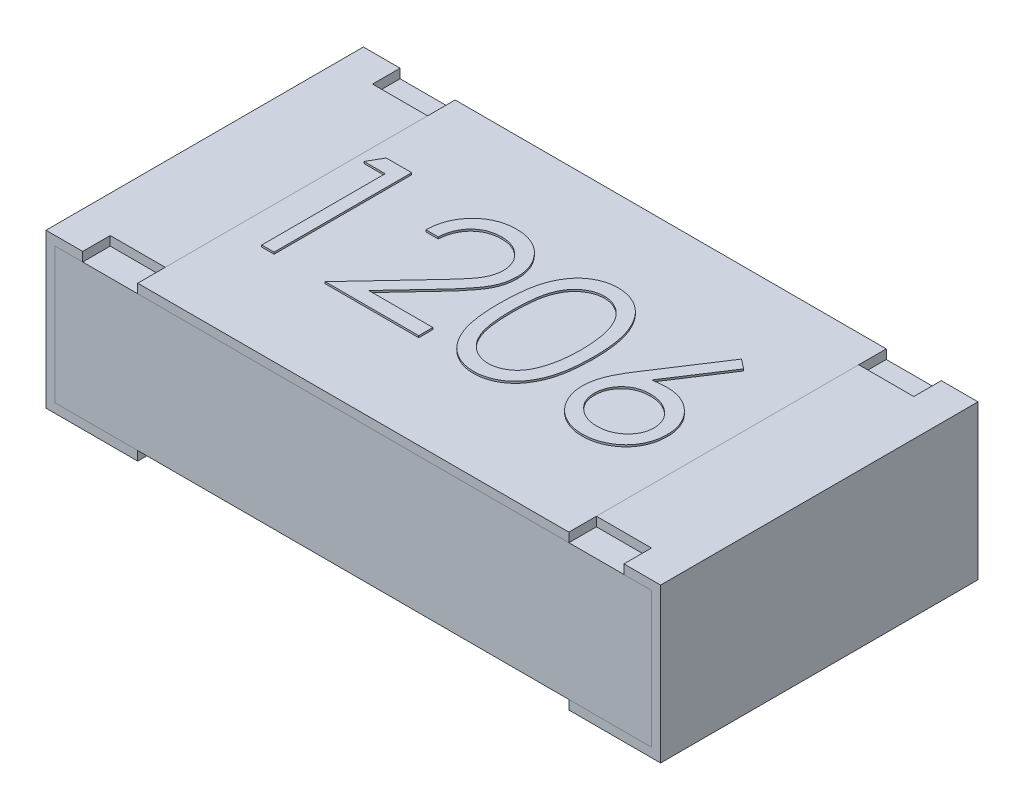
from build123d import *

# Parameters (mm, degrees)
CROQUIS1_W          = 3.25
CROQUIS1_H          = 1.73
EXTRUIR1_DEPTH      = 0.79
CROQUIS2_W          = 3.25
CROQUIS2_H          = 0.05
EXTRUIR2_DEPTH      = 3.501524535
CROQUIS4_W          = 1.73
CROQUIS4_H          = 0.05
EXTRUIR3_DEPTH      = 2.35
CROQUIS5_W          = 0.3
CROQUIS5_H          = 0.15
EXTRUIR4_DEPTH      = 0.05
BOSS_EXTRUDE1_DEPTH = 0.01


with BuildPart() as part:
    # Croquis1 → Extruir1 (new body)
    with BuildSketch(Plane(origin=(0, 0, 0), x_dir=(1, 0, 0), z_dir=(0, 1, 0))):
        Rectangle(CROQUIS1_W, CROQUIS1_H)
    extrude(amount=EXTRUIR1_DEPTH)

    # Croquis2 → Extruir2 (cut, through all)
    with BuildSketch(Plane.XY.offset(0.865)):
        with Locations((0, 0.025)):
            Rectangle(CROQUIS2_W, CROQUIS2_H)
    extrude(amount=-EXTRUIR2_DEPTH, mode=Mode.SUBTRACT)


with BuildPart() as body_2:
    # Barrer1: sweep along a path in Croquis3
    with BuildLine(Plane.XY.offset(0.865)) as barrer1_path:
        Line((-1.175, 0.84), (-1.675, 0.84))
        Line((-1.675, 0.84), (-1.675, 0))
        Line((-1.675, 0), (-1.175, 0))
    # Croquis3D1 → Barrer1 (sweep)
    with BuildSketch(Plane(origin=(-1.175, 0.84, 0.865), x_dir=(0, -0.02888967070388963, -0.9995826063545828), z_dir=(1, 0, 0))):
        Polygon((0, 0), (1.729277909, 0.04997913), (1.730722393, 0), (0.001444484, -0.04997913), align=None)
    sweep(path=barrer1_path.line, transition=Transition.RIGHT)


with BuildPart() as body_3:
    # Simetría1: mirrored copy
    add(body_2.part.mirror(Plane(origin=(0, 0.79, 0.865), x_dir=(0, 0, 1), z_dir=(1, 0, 0))))


with BuildPart() as body_4:
    # Croquis4 → Extruir3 (new body)
    with BuildSketch(Plane(origin=(-1.175, 0, 0), x_dir=(0, 0, -1), z_dir=(1, 0, 0))):
        with Locations((0, 0.815)):
            Rectangle(CROQUIS4_W, CROQUIS4_H)
    extrude(amount=EXTRUIR3_DEPTH)

    # Sketch1 → Boss-Extrude1 (add)
    # profile 1 of 4: a face of its own
    with BuildSketch(Plane(origin=(0, 0.84, 0), x_dir=(1, 0, 0), z_dir=(0, 1, 0))):
        Polygon((-1.07874573, 0.393272708), (-0.940073855, 0.393272708), (-0.940073855, -0.356727292), (-1.007381548, -0.356727292), (-1.007381548, 0.316349631), (-1.122766163, 0.316349631), align=None)
    # profile 2 of 4: a face of its own
    with BuildSketch(Plane(origin=(0, 0.84, 0), x_dir=(1, 0, 0), z_dir=(0, 1, 0))):
        with BuildLine():
            Line((-0.565073855, 0.162503478), (-0.632381548, 0.162503478))
            add(Edge.make_bspline(
                [(-0.632381548, 0.162503478), (-0.631942872, 0.171432954), (-0.631081325, 0.188970207), (-0.627046691, 0.214539615), (-0.621273646, 0.238979929), (-0.613111192, 0.262094911), (-0.602974132, 0.284088941), (-0.590817698, 0.304874659), (-0.576419015, 0.32437277), (-0.560089001, 0.342402523), (-0.542352864, 0.358942716), (-0.523215877, 0.373225983), (-0.503106228, 0.385294055), (-0.482084929, 0.395382893), (-0.459914808, 0.402955717), (-0.436797053, 0.40857464), (-0.412630095, 0.411955285), (-0.396164376, 0.412318668), (-0.387790201, 0.412503478)],
                knots=[0, 0, 0, 0, 1.10065271, 2.161652631, 3.183658789, 4.190468796, 5.17591951, 6.163126047, 7.15150782, 8.156236427, 9.156009102, 10.134482811, 11.092018607, 12.041330605, 13.001268258, 13.972401359, 14.968799086, 16, 16, 16, 16], degree=3))
            add(Edge.make_bspline(
                [(-0.387790201, 0.412503478), (-0.379566328, 0.412310951), (-0.363406712, 0.411932644), (-0.339821994, 0.408683852), (-0.317369717, 0.403595511), (-0.296093767, 0.396456493), (-0.276163896, 0.38685983), (-0.257430386, 0.375331786), (-0.239670213, 0.361998965), (-0.223683045, 0.346301719), (-0.209002742, 0.329544065), (-0.196337973, 0.3116538), (-0.185492295, 0.293176096), (-0.176452078, 0.273970053), (-0.169797191, 0.253854833), (-0.164744718, 0.233123289), (-0.161888844, 0.21156083), (-0.161450539, 0.196966568), (-0.161227701, 0.189546747)],
                knots=[0, 0, 0, 0, 1.111607364, 2.184268762, 3.212621178, 4.221274766, 5.211760367, 6.196651075, 7.1921475, 8.207485113, 9.220403448, 10.201281604, 11.166441695, 12.114753415, 13.065576456, 14.026450734, 14.996634279, 16, 16, 16, 16], degree=3))
            add(Edge.make_bspline(
                [(-0.161227701, 0.189546747), (-0.161590543, 0.179100782), (-0.16230986, 0.158392165), (-0.168462941, 0.127960409), (-0.178072908, 0.098476105), (-0.18964377, 0.074746683), (-0.201316436, 0.05562522), (-0.211835188, 0.039881926), (-0.224149076, 0.022930754), (-0.238437326, 0.004828468), (-0.25440437, -0.014566726), (-0.272194833, -0.035243111), (-0.291935579, -0.056987062), (-0.305790972, -0.071838262), (-0.31297049, -0.079533782)],
                knots=[0, 0, 0, 0, 1.184426356, 2.348067706, 3.509069118, 4.696110526, 5.333549288, 6.050745305, 6.844228056, 7.710549037, 8.667450064, 9.695053472, 10.805634456, 12, 12, 12, 12], degree=3))
            Line((-0.31297049, -0.079533782), (-0.50062073, -0.279804215))
            Line((-0.50062073, -0.279804215), (-0.151612317, -0.279804215))
            Line((-0.151612317, -0.279804215), (-0.151612317, -0.356727292))
            Line((-0.151612317, -0.356727292), (-0.661227701, -0.356727292))
            Line((-0.661227701, -0.356727292), (-0.370362317, -0.046330657))
            add(Edge.make_bspline(
                [(-0.370362317, -0.046330657), (-0.363280627, -0.038938163), (-0.34967815, -0.024738694), (-0.330439026, -0.00400806), (-0.313159243, 0.015223985), (-0.297726944, 0.032921102), (-0.284476907, 0.049342152), (-0.272718572, 0.063955303), (-0.263297374, 0.077402685), (-0.253072646, 0.09298996), (-0.24316965, 0.112021171), (-0.23465986, 0.13527839), (-0.229470964, 0.159219944), (-0.228848499, 0.175398952), (-0.228535394, 0.183537131)],
                knots=[0, 0, 0, 0, 1.329631726, 2.553950428, 3.673215718, 4.687767853, 5.603093632, 6.413772471, 7.123043292, 7.734684054, 8.834405432, 9.900288307, 10.943827018, 12, 12, 12, 12], degree=3))
            add(Edge.make_bspline(
                [(-0.228535394, 0.183537131), (-0.228671624, 0.188654574), (-0.228940108, 0.198740071), (-0.231309615, 0.213527019), (-0.234890438, 0.227790908), (-0.240021564, 0.241575612), (-0.246794437, 0.254742537), (-0.255038733, 0.267307711), (-0.264550889, 0.279455347), (-0.275554733, 0.290845339), (-0.287642916, 0.301277026), (-0.300413112, 0.310517902), (-0.313923849, 0.318240568), (-0.328118161, 0.324571318), (-0.342956475, 0.329537471), (-0.358467492, 0.332978595), (-0.374608353, 0.335139127), (-0.385629816, 0.33543145), (-0.39124573, 0.335580401)],
                knots=[0, 0, 0, 0, 0.991446411, 1.95395049, 2.89581595, 3.838931463, 4.798493298, 5.75982156, 6.748411868, 7.785213223, 8.824556874, 9.840280684, 10.836137867, 11.835679398, 12.848801643, 13.863922112, 14.911575587, 16, 16, 16, 16], degree=3))
            add(Edge.make_bspline(
                [(-0.39124573, 0.335580401), (-0.397110909, 0.33542718), (-0.408629151, 0.335126278), (-0.425540372, 0.333021422), (-0.441673039, 0.32939017), (-0.457067732, 0.32442374), (-0.471750501, 0.318111194), (-0.485649939, 0.310248677), (-0.498734843, 0.3008665), (-0.511029813, 0.290229238), (-0.522357808, 0.278386181), (-0.53231071, 0.265184046), (-0.541007285, 0.250863885), (-0.548594978, 0.235464339), (-0.554756911, 0.218845672), (-0.559465443, 0.201066878), (-0.563191196, 0.182205153), (-0.564435879, 0.169179778), (-0.565073855, 0.162503478)],
                knots=[0, 0, 0, 0, 1.031018746, 2.02475058, 2.990194455, 3.934040569, 4.864654155, 5.795059489, 6.735614925, 7.690564532, 8.649604399, 9.611025574, 10.590972636, 11.591080095, 12.624614302, 13.701020113, 14.821632451, 16, 16, 16, 16], degree=3))
        make_face()
    # profile 3 of 4: a face of its own
    with BuildSketch(Plane(origin=(0, 0.84, 0), x_dir=(1, 0, 0), z_dir=(0, 1, 0))):
        with BuildLine():
            add(Edge.make_bspline(
                [(-0.084304625, 0.017972228), (-0.084234335, 0.029993096), (-0.084097796, 0.053343807), (-0.082578849, 0.087369088), (-0.080055561, 0.11928915), (-0.076597553, 0.149105521), (-0.072389414, 0.176825899), (-0.06677181, 0.202376204), (-0.060383352, 0.225874691), (-0.052979257, 0.247397987), (-0.044624731, 0.267236067), (-0.035531675, 0.285755753), (-0.025339219, 0.302929024), (-0.01462988, 0.319029979), (-0.002970151, 0.333795056), (0.009308162, 0.34743277), (0.022684278, 0.359627931), (0.036703494, 0.370737853), (0.051492736, 0.380477025), (0.066630451, 0.389055469), (0.08222083, 0.396384012), (0.098306441, 0.402146248), (0.114742703, 0.406905715), (0.131587075, 0.41016049), (0.148867367, 0.412208399), (0.160531246, 0.412404185), (0.166446577, 0.412503478)],
                knots=[0, 0, 0, 0, 1.646270934, 3.197905019, 4.663502075, 6.030701355, 7.308322542, 8.50163776, 9.611534131, 10.641858119, 11.616356847, 12.558055219, 13.465016945, 14.349605745, 15.204443733, 16.039544428, 16.859896111, 17.680448484, 18.487036065, 19.28249412, 20.06191084, 20.843045899, 21.620316918, 22.403196591, 23.190181807, 24, 24, 24, 24], degree=3))
            add(Edge.make_bspline(
                [(0.166446577, 0.412503478), (0.172411323, 0.412398946), (0.184273325, 0.412191065), (0.201810548, 0.410193077), (0.218942623, 0.406877837), (0.235596509, 0.402180485), (0.251909007, 0.39635284), (0.267752523, 0.389048458), (0.283225469, 0.380545843), (0.298081959, 0.370555012), (0.312485091, 0.359415953), (0.326081083, 0.346823953), (0.338871173, 0.332906156), (0.351015881, 0.317811471), (0.362170652, 0.301250381), (0.37279353, 0.283510929), (0.382301823, 0.264282886), (0.391459254, 0.243887072), (0.399363608, 0.221759145), (0.406492089, 0.198023839), (0.412251868, 0.172400799), (0.417049569, 0.145024461), (0.420766333, 0.115794286), (0.423473328, 0.084772933), (0.424903274, 0.051939992), (0.425172567, 0.029491881), (0.42531076, 0.017972228)],
                knots=[0, 0, 0, 0, 0.810914788, 1.612654377, 2.396697861, 3.181598691, 3.963628158, 4.749916497, 5.551656086, 6.361998678, 7.18212741, 8.025565596, 8.878627764, 9.750805457, 10.657531673, 11.591944965, 12.560506719, 13.57287815, 14.630710178, 15.753379473, 16.941251878, 18.199788006, 19.531962791, 20.947069417, 22.433333509, 24, 24, 24, 24], degree=3))
            add(Edge.make_bspline(
                [(0.42531076, 0.017972228), (0.425171135, 0.006502819), (0.424899081, -0.015844857), (0.423489358, -0.048530066), (0.420712508, -0.079386789), (0.417238939, -0.108489031), (0.412428019, -0.135715664), (0.406512626, -0.161160903), (0.3999447, -0.184934632), (0.391837244, -0.206842092), (0.38296352, -0.22718889), (0.373308835, -0.246188993), (0.362965301, -0.264010341), (0.351696284, -0.280510287), (0.339684839, -0.295805714), (0.326673884, -0.309626633), (0.313030187, -0.322306062), (0.298584669, -0.333588554), (0.28349648, -0.343463869), (0.268076678, -0.352295409), (0.252051667, -0.359416701), (0.235784606, -0.365531352), (0.219042813, -0.370202878), (0.201847158, -0.373432989), (0.184285107, -0.375698386), (0.172413343, -0.375871203), (0.166446577, -0.375958061)],
                knots=[0, 0, 0, 0, 1.561518951, 3.042555995, 4.452378317, 5.7783523, 7.031515105, 8.214008947, 9.334062868, 10.386615937, 11.391082383, 12.354592575, 13.286541444, 14.194233754, 15.072674879, 15.931287219, 16.775624067, 17.606195743, 18.42308326, 19.229000347, 20.022332153, 20.807536673, 21.593273796, 22.3848459, 23.188221202, 24, 24, 24, 24], degree=3))
            add(Edge.make_bspline(
                [(0.166446577, -0.375958061), (0.16053141, -0.375858128), (0.148867855, -0.375661079), (0.131585192, -0.373622422), (0.114810383, -0.370344814), (0.09846065, -0.365755542), (0.082452111, -0.360138077), (0.067002907, -0.35281943), (0.05194126, -0.344390701), (0.037307355, -0.334791682), (0.023376178, -0.323794179), (0.010069334, -0.311630403), (-0.002278884, -0.297996814), (-0.013771905, -0.283108688), (-0.024694924, -0.267102993), (-0.034742647, -0.249761199), (-0.044036401, -0.231152068), (-0.052531435, -0.211155373), (-0.060063291, -0.189479317), (-0.066716372, -0.165875922), (-0.071969405, -0.140136857), (-0.076465753, -0.11246885), (-0.080092406, -0.082753007), (-0.082568333, -0.050973198), (-0.084098615, -0.017149224), (-0.084234702, 0.006051441), (-0.084304625, 0.017972228)],
                knots=[0, 0, 0, 0, 0.810891512, 1.598919785, 2.382837074, 3.152667961, 3.926044502, 4.706494248, 5.493654104, 6.291793342, 7.103789334, 7.925228297, 8.761435821, 9.622817696, 10.50288917, 11.416980706, 12.369136599, 13.353924996, 14.394355917, 15.514179734, 16.714354668, 17.994756427, 19.357759367, 20.818452758, 22.365282078, 24, 24, 24, 24], degree=3))
        make_face()
        with BuildLine():
            add(Edge.make_bspline(
                [(-0.016996932, 0.018272708), (-0.016971336, 0.00825513), (-0.01692166, -0.011187022), (-0.015623903, -0.03943915), (-0.013855996, -0.065789934), (-0.011575718, -0.090272835), (-0.008189372, -0.112804981), (-0.00439506, -0.133541341), (0.000222388, -0.152372178), (0.005685606, -0.169426709), (0.011908269, -0.184994366), (0.018702383, -0.199480341), (0.026001109, -0.213055756), (0.034169499, -0.225598672), (0.043065584, -0.237149993), (0.052488425, -0.247914171), (0.062789693, -0.257513524), (0.077040495, -0.269026422), (0.095854025, -0.280923379), (0.119558409, -0.291283255), (0.143915934, -0.297793782), (0.160448344, -0.29862173), (0.168700183, -0.299034984)],
                knots=[0, 0, 0, 0, 1.459021318, 2.831673884, 4.118529203, 5.306027144, 6.411944654, 7.436330062, 8.375795394, 9.233974572, 10.042671642, 10.816086306, 11.563610507, 12.285937304, 12.993564865, 13.685989202, 14.367179055, 15.041617293, 16.353048772, 17.594441528, 18.799311195, 20, 20, 20, 20], degree=3))
            add(Edge.make_bspline(
                [(0.168700183, -0.299034984), (0.177005399, -0.298692602), (0.193598682, -0.298008546), (0.217841638, -0.291408817), (0.241376696, -0.281451058), (0.259820683, -0.269676593), (0.273852657, -0.258463379), (0.283906298, -0.248903097), (0.293133879, -0.238198269), (0.301885753, -0.22664842), (0.309912697, -0.214032887), (0.317211941, -0.200412335), (0.323872658, -0.18574894), (0.327667454, -0.175512567), (0.329607635, -0.170278974)],
                knots=[0, 0, 0, 0, 1.353760809, 2.704726607, 4.075137775, 5.516104923, 6.260822281, 7.007110065, 7.778089737, 8.566572457, 9.372053459, 10.217411131, 11.088608312, 12, 12, 12, 12], degree=3))
            add(Edge.make_bspline(
                [(0.329607635, -0.170278974), (0.331868728, -0.163586887), (0.336459717, -0.149999081), (0.342376526, -0.128921155), (0.347036254, -0.106806277), (0.351228404, -0.083786609), (0.354089773, -0.059692388), (0.356392876, -0.034598163), (0.357749452, -0.008485014), (0.357917613, 0.00925677), (0.358003068, 0.018272708)],
                knots=[0, 0, 0, 0, 0.884706709, 1.796334032, 2.740027952, 3.714592787, 4.726048262, 5.777819803, 6.87074269, 8, 8, 8, 8], degree=3))
            add(Edge.make_bspline(
                [(0.358003068, 0.018272708), (0.35788517, 0.027287188), (0.357654537, 0.044921438), (0.356772968, 0.070746762), (0.354496488, 0.095275568), (0.351968105, 0.118613527), (0.348240129, 0.140631449), (0.344220599, 0.161513657), (0.33882034, 0.181001448), (0.333051816, 0.19939993), (0.326449589, 0.21650007), (0.319181931, 0.232381596), (0.311420126, 0.247121179), (0.302989646, 0.260678381), (0.293990571, 0.273113926), (0.284185382, 0.284178482), (0.273963016, 0.294214975), (0.259645048, 0.30567124), (0.240900557, 0.317352318), (0.21757649, 0.328102123), (0.193304209, 0.334275329), (0.176895612, 0.33514569), (0.168700183, 0.335580401)],
                knots=[0, 0, 0, 0, 1.31362396, 2.569729283, 3.763502607, 4.902122613, 5.988968491, 7.01645872, 7.998833611, 8.933434873, 9.825090667, 10.667526885, 11.477055099, 12.250526234, 12.991942729, 13.710640831, 14.402115721, 15.076753259, 16.378508321, 17.609869233, 18.806226677, 20, 20, 20, 20], degree=3))
            add(Edge.make_bspline(
                [(0.168700183, 0.335580401), (0.160405056, 0.335145091), (0.143799691, 0.334273678), (0.119275129, 0.328125123), (0.095767054, 0.317408059), (0.077072131, 0.305632551), (0.062744176, 0.294417198), (0.052655028, 0.28469153), (0.043195134, 0.274053047), (0.034480627, 0.262395493), (0.026318637, 0.2498672), (0.018822706, 0.236369608), (0.012068993, 0.221834316), (0.005836592, 0.206273651), (0.000356709, 0.189220591), (-0.004163426, 0.17041295), (-0.008339223, 0.149742545), (-0.011295352, 0.127088364), (-0.0139233, 0.102599331), (-0.01561216, 0.076182763), (-0.016926001, 0.047883253), (-0.016972815, 0.028340576), (-0.016996932, 0.018272708)],
                knots=[0, 0, 0, 0, 1.207732386, 2.417664972, 3.655092373, 4.956220595, 5.625982001, 6.301752483, 6.994047911, 7.697131622, 8.419323945, 9.170223765, 9.943494443, 10.752040957, 11.610060368, 12.549350801, 13.567764191, 14.679664412, 15.874934091, 17.154273443, 18.533957287, 20, 20, 20, 20], degree=3))
        make_face(mode=Mode.SUBTRACT)
    # profile 4 of 4: a face of its own
    with BuildSketch(Plane(origin=(0, 0.84, 0), x_dir=(1, 0, 0), z_dir=(0, 1, 0))):
        with BuildLine():
            Line((0.838772299, 0.412503478), (0.890605231, 0.371788333))
            Line((0.890605231, 0.371788333), (0.692438164, 0.068753478))
            add(Edge.make_bspline(
                [(0.692438164, 0.068753478), (0.705631795, 0.070856448), (0.731367463, 0.074958529), (0.757417299, 0.075635231), (0.770112443, 0.075965016)],
                knots=[0, 0, 0, 0, 1.025318673, 2, 2, 2, 2], degree=3))
            add(Edge.make_bspline(
                [(0.770112443, 0.075965016), (0.777735121, 0.075760135), (0.792740135, 0.075356833), (0.814770164, 0.07225315), (0.835939222, 0.067362055), (0.856159567, 0.060232286), (0.875503778, 0.051124639), (0.894082862, 0.040209166), (0.911547579, 0.026922235), (0.928122832, 0.012079744), (0.943171495, -0.00435961), (0.956494936, -0.021802753), (0.967686391, -0.040231513), (0.976766517, -0.059636556), (0.983817563, -0.079987969), (0.988957772, -0.101259713), (0.991996256, -0.123466457), (0.992408862, -0.138568923), (0.992618452, -0.146240513)],
                knots=[0, 0, 0, 0, 1.04369286, 2.054478336, 3.041073146, 4.015093852, 4.984733326, 5.965804835, 6.960378782, 7.985147595, 9.009457201, 10.008161701, 10.986880575, 11.956520048, 12.937015923, 13.931873656, 14.949455224, 16, 16, 16, 16], degree=3))
            add(Edge.make_bspline(
                [(0.992618452, -0.146240513), (0.992313501, -0.156736164), (0.99171343, -0.177389121), (0.985734045, -0.207469843), (0.976442693, -0.236126811), (0.963161794, -0.262902491), (0.946665569, -0.287760184), (0.926548942, -0.309785641), (0.903525337, -0.32942922), (0.877492452, -0.345855639), (0.849476102, -0.359270578), (0.820043531, -0.368905987), (0.789480571, -0.374838159), (0.768736727, -0.37558186), (0.758243452, -0.375958061)],
                knots=[0, 0, 0, 0, 1.031375318, 2.029502543, 3.004789286, 3.987476834, 4.960371455, 5.9300674, 6.912260825, 7.929083631, 8.949397511, 9.960523116, 10.96833055, 12, 12, 12, 12], degree=3))
            add(Edge.make_bspline(
                [(0.758243452, -0.375958061), (0.748151302, -0.375630588), (0.72816052, -0.374981922), (0.698753493, -0.369203507), (0.670497132, -0.359837699), (0.643589407, -0.346934639), (0.618663562, -0.330636522), (0.596363782, -0.311016033), (0.576801259, -0.288492577), (0.560520983, -0.263069645), (0.547608398, -0.235750368), (0.537924842, -0.207263835), (0.532268505, -0.177713839), (0.5314781, -0.157682166), (0.531079991, -0.147592676)],
                knots=[0, 0, 0, 0, 1.012016664, 2.004627821, 2.994792927, 3.992885782, 4.990978636, 5.973936114, 6.964471063, 7.975201453, 8.993600317, 9.990122807, 10.98767138, 12, 12, 12, 12], degree=3))
            add(Edge.make_bspline(
                [(0.531079991, -0.147592676), (0.531333158, -0.139868837), (0.531850076, -0.124098233), (0.535459374, -0.100213084), (0.541258973, -0.075773567), (0.547754025, -0.055040525), (0.554616656, -0.038055913), (0.560327915, -0.024362308), (0.567436628, -0.01027065), (0.575016638, 0.004702272), (0.583750253, 0.020170579), (0.593246464, 0.036392794), (0.603767817, 0.053110922), (0.611143567, 0.064456106), (0.614914125, 0.070255881)],
                knots=[0, 0, 0, 0, 1.173818275, 2.396712641, 3.66331629, 4.989737886, 5.693666774, 6.447286557, 7.243889047, 8.091586357, 8.998013824, 9.943181721, 10.948533338, 12, 12, 12, 12], degree=3))
            Line((0.614914125, 0.070255881), (0.838772299, 0.412503478))
        make_face()
        with BuildLine():
            add(Edge.make_bspline(
                [(0.755989847, -0.000958061), (0.750276508, -0.001124784), (0.739116699, -0.001450444), (0.722743682, -0.00334157), (0.707247985, -0.006902798), (0.692424314, -0.01143844), (0.678549806, -0.01767481), (0.665523626, -0.025250196), (0.6532954, -0.03416902), (0.641993211, -0.044304929), (0.63174614, -0.055402365), (0.622921612, -0.067288691), (0.615309669, -0.079677449), (0.609120708, -0.092672151), (0.604301406, -0.106267829), (0.600815352, -0.120401954), (0.598875263, -0.135169306), (0.598552499, -0.145183413), (0.598387683, -0.150297003)],
                knots=[0, 0, 0, 0, 1.129588631, 2.206414736, 3.251139165, 4.268635594, 5.265702196, 6.250456724, 7.242448911, 8.251968645, 9.246821453, 10.222880186, 11.173611482, 12.116736599, 13.062300278, 14.020270554, 14.989073742, 16, 16, 16, 16], degree=3))
            add(Edge.make_bspline(
                [(0.598387683, -0.150297003), (0.598521903, -0.155364856), (0.59878509, -0.165302161), (0.601174872, -0.179946271), (0.604825247, -0.194038751), (0.610255332, -0.207506951), (0.616732522, -0.220556162), (0.625283663, -0.232713723), (0.634758689, -0.244718024), (0.646084532, -0.255646911), (0.658239538, -0.265816187), (0.67122551, -0.274704813), (0.684759787, -0.282308993), (0.699025092, -0.288268514), (0.713819031, -0.293159432), (0.729264864, -0.296601178), (0.745373333, -0.298547005), (0.756285177, -0.298870189), (0.761849222, -0.299034984)],
                knots=[0, 0, 0, 0, 0.989467248, 1.94019797, 2.891935182, 3.827694429, 4.772920941, 5.730924762, 6.725747692, 7.756678648, 8.79901574, 9.819492441, 10.826891316, 11.826466727, 12.835195252, 13.867842842, 14.912794438, 16, 16, 16, 16], degree=3))
            add(Edge.make_bspline(
                [(0.761849222, -0.299034984), (0.767413257, -0.298870176), (0.778325083, -0.298546967), (0.794433682, -0.296601323), (0.809879036, -0.293158899), (0.824674716, -0.288270448), (0.838933594, -0.282301817), (0.852456034, -0.27475212), (0.865319197, -0.265761524), (0.877482183, -0.255664289), (0.888760884, -0.244655821), (0.898463158, -0.23282088), (0.906752422, -0.220457903), (0.91348832, -0.207558355), (0.918858596, -0.194030608), (0.922527482, -0.179948452), (0.92491233, -0.16530159), (0.925176194, -0.155364663), (0.92531076, -0.150297003)],
                knots=[0, 0, 0, 0, 1.087397944, 2.132534446, 3.165364764, 4.174271784, 5.174024072, 6.181601208, 7.194203697, 8.236725232, 9.267838612, 10.269026844, 11.221737037, 12.171628256, 13.107553087, 14.05945871, 15.010357665, 16, 16, 16, 16], degree=3))
            add(Edge.make_bspline(
                [(0.92531076, -0.150297003), (0.92519284, -0.145176742), (0.924961402, -0.135127335), (0.922343698, -0.12040856), (0.91871319, -0.106196016), (0.913231112, -0.092579027), (0.906108995, -0.079611328), (0.897433979, -0.067227413), (0.887398428, -0.055332339), (0.875806099, -0.044283166), (0.863186763, -0.034180221), (0.849769137, -0.025261744), (0.835731714, -0.017734963), (0.821088727, -0.01145487), (0.805672395, -0.00692284), (0.789731608, -0.003354288), (0.773062484, -0.001455284), (0.761753211, -0.001125913), (0.755989847, -0.000958061)],
                knots=[0, 0, 0, 0, 0.978206639, 1.919901502, 2.851605144, 3.780102724, 4.718870031, 5.675451981, 6.667674623, 7.690630536, 8.733308323, 9.756129687, 10.767539656, 11.776269907, 12.797430371, 13.836405707, 14.897401972, 16, 16, 16, 16], degree=3))
        make_face(mode=Mode.SUBTRACT)
    extrude(amount=BOSS_EXTRUDE1_DEPTH)


with BuildPart() as extruir4_tool:
    # Croquis5 → Extruir4 (new body)
    with BuildSketch(Plane(origin=(0, 0.84, 0), x_dir=(1, 0, 0), z_dir=(0, 1, 0))):
        with Locations((-1.325, -0.79)):
            Rectangle(CROQUIS5_W, CROQUIS5_H)
        with Locations((-1.325, 0.79)):
            Rectangle(CROQUIS5_W, CROQUIS5_H)
        with Locations((1.325, 0.79)):
            Rectangle(CROQUIS5_W, CROQUIS5_H)
        with Locations((1.325, -0.79)):
            Rectangle(CROQUIS5_W, CROQUIS5_H)
    extrude(amount=-EXTRUIR4_DEPTH)


with BuildPart() as body_2_1:
    add(body_2.part)

    # Extruir4: cut by extruir4_tool
    add(extruir4_tool.part, mode=Mode.SUBTRACT)


with BuildPart() as body_3_1:
    add(body_3.part)

    # Extruir4: cut by extruir4_tool
    add(extruir4_tool.part, mode=Mode.SUBTRACT)


solid = Compound([part.part, body_4.part, body_2_1.part, body_3_1.part])
